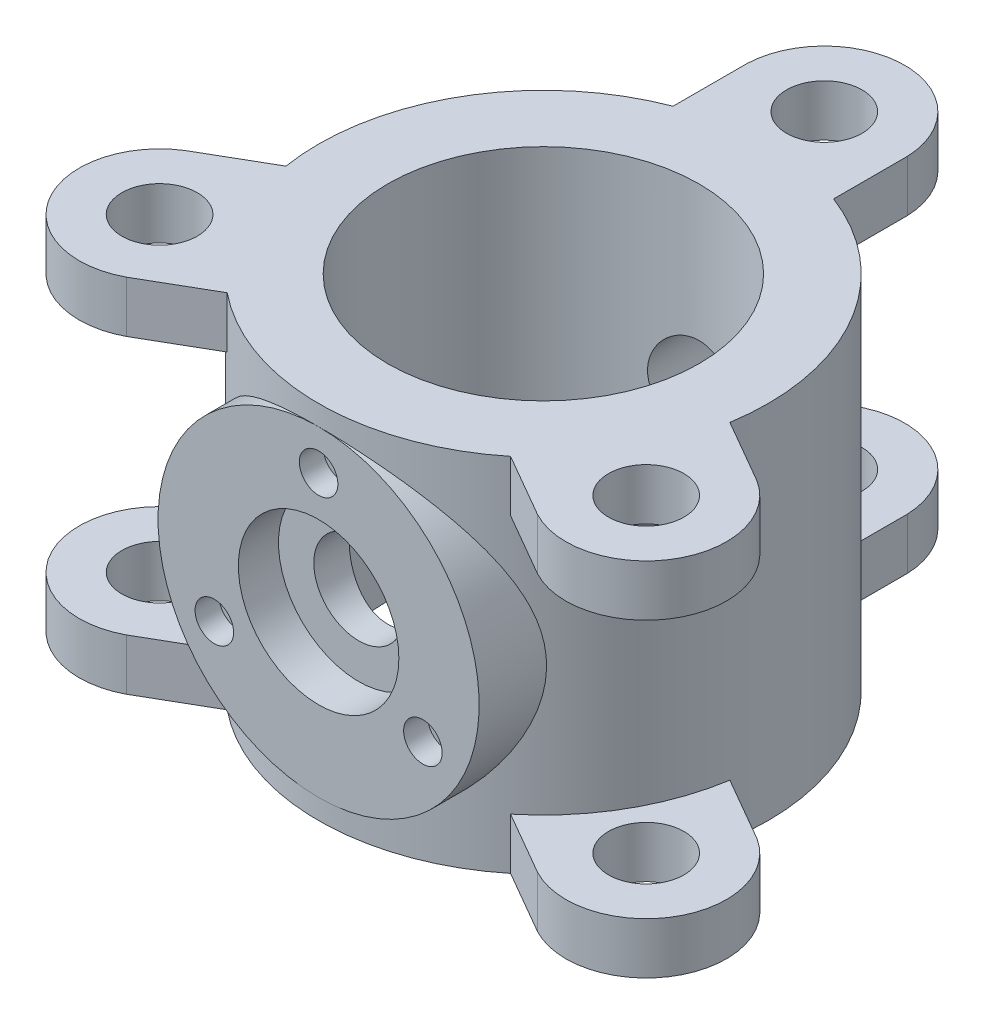
from build123d import *
from build123d.topology import SkipClean

# Parameters (mm, degrees)
SKETCH1_R               = 140
SKETCH1_R_2             = 97
BOSS_EXTRUDE1_DEPTH     = 225
SKETCH5_R               = 23.5
BOSS_EXTRUDE2_DEPTH     = 32
CIRPATTERN1_COUNT       = 3
MIRROR1_COPY_1_SKETCH_R = 23.5
MIRROR1_COPY_1_DEPTH    = 32
MIRROR1_COPY_2_SKETCH_R = 23.5
MIRROR1_COPY_2_DEPTH    = 32
BOSS_EXTRUDE3_START     = -42.02041
SKETCH6_R               = 100
BOSS_EXTRUDE3_DEPTH     = 42.02041
SKETCH7_R               = 50
CUT_EXTRUDE1_DEPTH      = 25
SKETCH8_R               = 28
CUT_EXTRUDE2_DEPTH      = 455.845123838
SKETCH9_R               = 12
CUT_EXTRUDE3_DEPTH      = 15
CIRPATTERN2_COUNT       = 3


with BuildPart() as part:
    # Sketch1 → Boss-Extrude1 (new body)
    with BuildSketch(Plane(origin=(0, 0, 0), x_dir=(1, 0, 0), z_dir=(0, 1, 0))):
        with Locations(Location((0, 0, 0), (0, 0, 270))):
            Circle(SKETCH1_R)
        with Locations(Location((0, 0, 0), (0, 0, 270))):
            Circle(SKETCH1_R_2, mode=Mode.SUBTRACT)
    extrude(amount=BOSS_EXTRUDE1_DEPTH)

    # Sketch5 → Boss-Extrude2 (add)
    with BuildSketch(Plane(origin=(0, 0, 0), x_dir=(-1, 0, 0), z_dir=(0, -1, 0))):
        with BuildLine():
            ThreePointArc((50, 176.795082097), (0, 225.032212821), (-50, 176.795082097))
            Line((-50, 176.795082097), (-50, 173.204917903))
            Line((-50, 173.204917903), (-50, 130.766968306))
            ThreePointArc((-50, 130.766968306), (0, 140), (50, 130.766968306))
            Line((50, 130.766968306), (50, 173.204917903))
            Line((50, 173.204917903), (50, 176.795082097))
        make_face()
        with Locations(Location((0, 175, 0), (0, 0, 90))):
            Circle(SKETCH5_R, mode=Mode.SUBTRACT)
    boss_extrude2 = extrude(amount=-BOSS_EXTRUDE2_DEPTH)

    # CirPattern1: Boss-Extrude2 ×3 about axis
    cirpattern1_axis = Axis((0, 0, 0), (0, 1, 0))
    for i in range(1, CIRPATTERN1_COUNT):
        add(boss_extrude2.rotate(cirpattern1_axis, i * 360 / CIRPATTERN1_COUNT))

    # Mirror1: Boss-Extrude2 across plane
    add(boss_extrude2.mirror(Plane(origin=(0, 112.5, 0), x_dir=(0, 0, 1), z_dir=(0, -1, 0))))

    # Mirror1 copy 1 sketch → Mirror1 copy 1 (add)
    with BuildSketch(Plane(origin=(0, 225, 0), x_dir=(0.4999999999999998, 0, 0.8660254037844387), z_dir=(0, 1, 0))):
        with BuildLine():
            ThreePointArc((50, -176.795082097), (0, -225.032212821), (-50, -176.795082097))
            Line((-50, -176.795082097), (-50, -173.204917903))
            Line((-50, -173.204917903), (-50, -130.766968306))
            ThreePointArc((-50, -130.766968306), (0, -140), (50, -130.766968306))
            Line((50, -130.766968306), (50, -173.204917903))
            Line((50, -173.204917903), (50, -176.795082097))
        make_face()
        with Locations((0, -175)):
            Circle(MIRROR1_COPY_1_SKETCH_R, mode=Mode.SUBTRACT)
    extrude(amount=-MIRROR1_COPY_1_DEPTH)

    # Mirror1 copy 2 sketch → Mirror1 copy 2 (add)
    with BuildSketch(Plane(origin=(0, 225, 0), x_dir=(0.5000000000000004, 0, -0.8660254037844384), z_dir=(0, 1, 0))):
        with BuildLine():
            ThreePointArc((50, -176.795082097), (0, -225.032212821), (-50, -176.795082097))
            Line((-50, -176.795082097), (-50, -173.204917903))
            Line((-50, -173.204917903), (-50, -130.766968306))
            ThreePointArc((-50, -130.766968306), (0, -140), (50, -130.766968306))
            Line((50, -130.766968306), (50, -173.204917903))
            Line((50, -173.204917903), (50, -176.795082097))
        make_face()
        with Locations((0, -175)):
            Circle(MIRROR1_COPY_2_SKETCH_R, mode=Mode.SUBTRACT)
    extrude(amount=-MIRROR1_COPY_2_DEPTH)

    # Sketch6 → Boss-Extrude3 (add)
    with SkipClean():  # the faces are left unmerged after this step: merging them gives an invalid solid
        with BuildSketch(Plane.XY.offset(140).offset(BOSS_EXTRUDE3_START)):
            with Locations((0, 112.5)):
                Circle(SKETCH6_R)
        extrude(amount=BOSS_EXTRUDE3_DEPTH)

    # Sketch7 → Cut-Extrude1 (cut)
    with SkipClean():  # the faces are left unmerged after this step: merging them gives an invalid solid
        with BuildSketch(Plane.XY.offset(140)):
            with Locations((0, 112.5)):
                Circle(SKETCH7_R)
        extrude(amount=-CUT_EXTRUDE1_DEPTH, mode=Mode.SUBTRACT)

    # Sketch8 → Cut-Extrude2 (cut, through all)
    with SkipClean():  # the faces are left unmerged after this step: merging them gives an invalid solid
        with BuildSketch(Plane.XY.offset(115)):
            with Locations((0, 112.5)):
                Circle(SKETCH8_R)
        extrude(amount=-CUT_EXTRUDE2_DEPTH, mode=Mode.SUBTRACT)

    # Sketch9 → Cut-Extrude3 (cut)
    with SkipClean():  # the faces are left unmerged after this step: merging them gives an invalid solid
        with BuildSketch(Plane.XY.offset(140)):
            with Locations((0, 187.5)):
                Circle(SKETCH9_R)
        cut_extrude3 = extrude(amount=-CUT_EXTRUDE3_DEPTH, mode=Mode.SUBTRACT)

    # CirPattern2: Cut-Extrude3 ×3 about axis
    with SkipClean():  # the faces are left unmerged after this step: merging them gives an invalid solid
        cirpattern2_axis = Axis((0, 112.5, 0), (0, 0, 1))
        for i in range(1, CIRPATTERN2_COUNT):
            add(cut_extrude3.rotate(cirpattern2_axis, i * 360 / CIRPATTERN2_COUNT), mode=Mode.SUBTRACT)


solid = part.part
